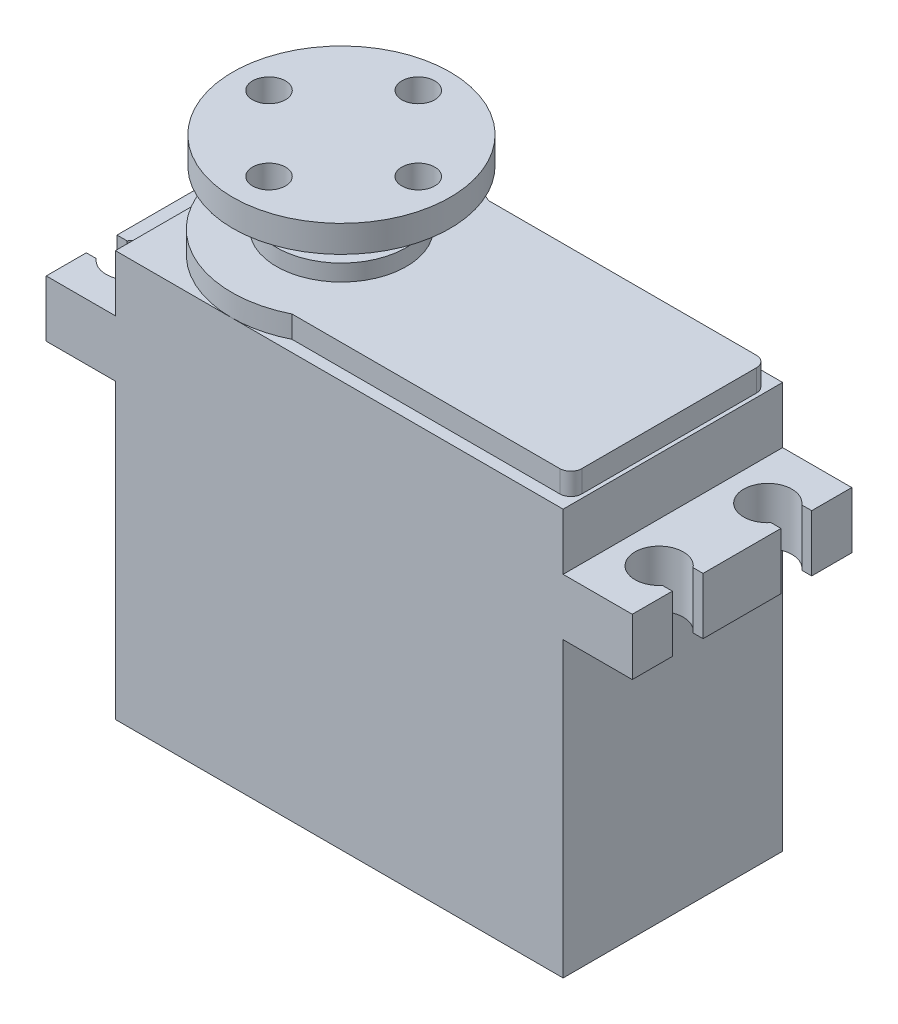
from build123d import *

# Parameters (mm, degrees)
SKETCH9_W                         = 53.4
SKETCH9_H                         = 37
BOSS_EXTRUDE3_DEPTH               = 20
BOSS_EXTRUDE4_DEPTH               = 2
SKETCH15_W                        = 6.3
SKETCH15_H                        = 26.7
CUT_EXTRUDE1_DEPTH                = 52.321438016
SKETCH16_W                        = 6.3
SKETCH16_H                        = 5.145561791
CUT_EXTRUDE2_DEPTH                = 52.321438016
SKETCH17_W                        = 6.3
SKETCH17_H                        = 5.145561791
CUT_EXTRUDE3_DEPTH                = 52.321438016
CUT_EXTRUDE4_DEPTH                = 43.750382848
CUT_EXTRUDE5_DEPTH                = 43.750382848
SKETCH30_W                        = 6.3
SKETCH30_H                        = 26.7
CUT_EXTRUDE6_DEPTH                = 52.321438016
CUT_EXTRUDE7_DEPTH                = 43.750382848
CUT_EXTRUDE8_DEPTH                = 43.750382848
SKETCH40_W                        = 5.917139292
SKETCH40_H                        = 1.5
SKETCH47_W                        = 2.2
SKETCH47_H                        = 5.154438209
SKETCH55_W                        = 2.2
SKETCH55_H                        = 5.154438209
SKETCH64_W                        = 2.2
SKETCH64_H                        = 5.154438209
SKETCH72_W                        = 2.2
SKETCH72_H                        = 5.154438209
F_3_0_3_DIAMETER_HOLE2_D          = 3
F_3_0_3_DIAMETER_HOLE2_DEPTH      = 1.5
FILLET1_R                         = 1
SKETCH76_W                        = 9.9
SKETCH76_H                        = 2.45
SKETCH85_R                        = 4.5
BOSS_EXTRUDE5_DEPTH               = 2.25
BOSS_EXTRUDE6_START               = 1.25
SKETCH86_R                        = 1.5
BOSS_EXTRUDE6_DEPTH               = 1.25
SKETCH87_W                        = 1.5
SKETCH87_H                        = 46.45
F_3_0_3_DIAMETER_HOLE3_AT_2_COUNT = 2
F_3_0_3_DIAMETER_HOLE3_AT_2_PITCH = 9.617734802
F_3_0_3_DIAMETER_HOLE3_AT_3_COUNT = 2
F_3_0_3_DIAMETER_HOLE3_AT_3_PITCH = 13.601530997
F_3_0_3_DIAMETER_HOLE3_AT_4_COUNT = 2
F_3_0_3_DIAMETER_HOLE3_AT_4_PITCH = 9.617734802
SKETCH89_W                        = 40.8
SKETCH89_H                        = 20
BOSS_EXTRUDE7_DEPTH               = 10
BOSS_EXTRUDE8_DEPTH               = 10
SKETCH91_R                        = 5.917139292
BOSS_EXTRUDE9_DEPTH               = 10


with BuildPart() as part:
    # Sketch9 → Boss-Extrude3 (new body)
    with BuildSketch(Plane(origin=(0, 0, -10), x_dir=(-1, 0, 0), z_dir=(0, 0, -1))):
        with Locations((0, 18.5)):
            Rectangle(SKETCH9_W, SKETCH9_H)
    extrude(amount=-BOSS_EXTRUDE3_DEPTH)

    # Sketch10 → Boss-Extrude4 (add)
    with BuildSketch(Plane(origin=(0, 37, 0), x_dir=(-1, 0, 0), z_dir=(0, 1, 0))):
        with BuildLine():
            Line((-20.05, -8.952596504), (-20.05, 8.952596504))
            Line((-20.05, 8.952596504), (5.344552118, 8.952596504))
            ThreePointArc((5.344552118, 8.952596504), (19.8, 0), (5.344552118, -8.952596504))
            Line((5.344552118, -8.952596504), (-20.05, -8.952596504))
        make_face()
    extrude(amount=BOSS_EXTRUDE4_DEPTH)

    # Sketch15 → Cut-Extrude1 (cut, through all)
    with BuildSketch(Plane.XY.offset(10)):
        with Locations((-23.55, 13.35)):
            Rectangle(SKETCH15_W, SKETCH15_H)
    extrude(amount=-CUT_EXTRUDE1_DEPTH, mode=Mode.SUBTRACT)

    # Sketch16 → Cut-Extrude2 (cut, through all)
    with BuildSketch(Plane.XY.offset(10)):
        with Locations((-23.55, 34.427219104)):
            Rectangle(SKETCH16_W, SKETCH16_H)
    extrude(amount=-CUT_EXTRUDE2_DEPTH, mode=Mode.SUBTRACT)

    # Sketch17 → Cut-Extrude3 (cut, through all)
    with BuildSketch(Plane.XY.offset(10)):
        with Locations((23.55, 34.427219104)):
            Rectangle(SKETCH17_W, SKETCH17_H)
    extrude(amount=-CUT_EXTRUDE3_DEPTH, mode=Mode.SUBTRACT)

    # Sketch23 → Cut-Extrude4 (cut, through all)
    with BuildSketch(Plane(origin=(0, 31.854438209, 0), x_dir=(1, 0, 0), z_dir=(0, 1, 0))):
        with BuildLine():
            Line((-26.7, -3.55), (-26.7, -6.35))
            Line((-26.7, -6.35), (-25.797056275, -6.35))
            ThreePointArc((-25.797056275, -6.35), (-26.3, -4.95), (-25.797056275, -3.55))
            Line((-25.797056275, -3.55), (-26.7, -3.55))
        make_face()
    extrude(amount=-CUT_EXTRUDE4_DEPTH, mode=Mode.SUBTRACT)

    # Sketch24 → Cut-Extrude5 (cut, through all)
    with BuildSketch(Plane(origin=(0, 31.854438209, 0), x_dir=(-1, 0, 0), z_dir=(0, 1, 0))):
        with BuildLine():
            Line((26.7, -3.55), (25.797056275, -3.55))
            ThreePointArc((25.797056275, -3.55), (26.3, -4.95), (25.797056275, -6.35))
            Line((25.797056275, -6.35), (26.7, -6.35))
            Line((26.7, -6.35), (26.7, -3.55))
        make_face()
    extrude(amount=-CUT_EXTRUDE5_DEPTH, mode=Mode.SUBTRACT)

    # Sketch30 → Cut-Extrude6 (cut, through all)
    with BuildSketch(Plane.XY.offset(10)):
        with Locations((23.55, 13.35)):
            Rectangle(SKETCH30_W, SKETCH30_H)
    extrude(amount=-CUT_EXTRUDE6_DEPTH, mode=Mode.SUBTRACT)

    # Sketch37 → Cut-Extrude7 (cut, through all)
    with BuildSketch(Plane(origin=(0, 31.854438209, 0), x_dir=(1, 0, 0), z_dir=(0, 1, 0))):
        with BuildLine():
            Line((26.7, 3.55), (26.7, 6.35))
            Line((26.7, 6.35), (25.797056275, 6.35))
            ThreePointArc((25.797056275, 6.35), (26.3, 4.95), (25.797056275, 3.55))
            Line((25.797056275, 3.55), (26.7, 3.55))
        make_face()
    extrude(amount=-CUT_EXTRUDE7_DEPTH, mode=Mode.SUBTRACT)

    # Sketch38 → Cut-Extrude8 (cut, through all)
    with BuildSketch(Plane(origin=(0, 31.854438209, 0), x_dir=(-1, 0, 0), z_dir=(0, 1, 0))):
        with BuildLine():
            Line((-26.7, 3.55), (-25.797056275, 3.55))
            ThreePointArc((-25.797056275, 3.55), (-26.3, 4.95), (-25.797056275, 6.35))
            Line((-25.797056275, 6.35), (-26.7, 6.35))
            Line((-26.7, 6.35), (-26.7, 3.55))
        make_face()
    extrude(amount=-CUT_EXTRUDE8_DEPTH, mode=Mode.SUBTRACT)

    # Sketch40 → Revolve2 (revolve)
    with BuildSketch(Plane.XY, mode=Mode.PRIVATE) as revolve2_sk:
        with Locations((-6.841430354, 39.75)):
            Rectangle(SKETCH40_W, SKETCH40_H)
    revolve(revolve2_sk.sketch.rotate(Axis((-9.8, 40.5, 0), (0, -1, 0)), 270), axis=Axis((-9.8, 40.5, 0), (0, -1, 0)))

    # Sketch47 → Cut-Revolve1 (revolve, cut)
    with BuildSketch(Plane(origin=(0, 0, -4.95), x_dir=(-1, 0, 0), z_dir=(0, 0, -1))):
        with Locations((23, 29.277219105)):
            Rectangle(SKETCH47_W, SKETCH47_H)
    revolve(axis=Axis((-24.1, 26.7, -4.95), (0, 1, 0)), mode=Mode.SUBTRACT)

    # Sketch55 → Cut-Revolve2 (revolve, cut)
    with BuildSketch(Plane(origin=(0, 0, 4.95), x_dir=(-1, 0, 0), z_dir=(0, 0, -1))):
        with Locations((-25.2, 29.277219105)):
            Rectangle(SKETCH55_W, SKETCH55_H)
    revolve(axis=Axis((24.1, 26.7, 4.95), (0, 1, 0)), mode=Mode.SUBTRACT)

    # Sketch64 → Cut-Revolve3 (revolve, cut)
    with BuildSketch(Plane(origin=(0, 0, 4.95), x_dir=(-1, 0, 0), z_dir=(0, 0, -1))):
        with Locations((23, 29.277219105)):
            Rectangle(SKETCH64_W, SKETCH64_H)
    revolve(axis=Axis((-24.1, 26.7, 4.95), (0, 1, 0)), mode=Mode.SUBTRACT)

    # Sketch72 → Cut-Revolve4 (revolve, cut)
    with BuildSketch(Plane(origin=(0, 0, -4.95), x_dir=(-1, 0, 0), z_dir=(0, 0, -1))):
        with Locations((-25.2, 29.277219105)):
            Rectangle(SKETCH72_W, SKETCH72_H)
    revolve(axis=Axis((24.1, 26.7, -4.95), (0, 1, 0)), mode=Mode.SUBTRACT)

    # Ø3.0 (3) Diameter Hole2
    with Locations(Plane(origin=(0, 40.5, 0), x_dir=(1, 0, 0), z_dir=(0, 1, 0))):
        with Locations((-9.8, 0)):
            Hole(F_3_0_3_DIAMETER_HOLE2_D / 2, depth=F_3_0_3_DIAMETER_HOLE2_DEPTH)

    # Fillet1
    fillet1_edges = [part.edges().sort_by_distance(p)[0] for p in [
        (20.05, 38, 8.952596504),
        (20.05, 38, -8.952596504),
    ]]
    fillet(fillet1_edges, radius=FILLET1_R)


with BuildPart() as body_2:
    # Sketch76 → Revolve3 (revolve)
    with BuildSketch(Plane.XY, mode=Mode.PRIVATE) as revolve3_sk:
        with Locations((-4.85, 45.225)):
            Rectangle(SKETCH76_W, SKETCH76_H)
    revolve(revolve3_sk.sketch.rotate(Axis((-9.8, 46.45, 0), (0, -1, 0)), 270), axis=Axis((-9.8, 46.45, 0), (0, -1, 0)))

    # Sketch85 → Boss-Extrude5 (add)
    with BuildSketch(Plane(origin=(0, 44, 0), x_dir=(-1, 0, 0), z_dir=(0, -1, 0))):
        with Locations(Location((9.8, 0, 0), (0, 0, 90))):
            Circle(SKETCH85_R)
    extrude(amount=BOSS_EXTRUDE5_DEPTH)

    # Sketch86 → Boss-Extrude6 (add)
    with BuildSketch(Plane.XZ.offset(-41.75).offset(BOSS_EXTRUDE6_START)):
        with Locations(Location((-9.8, 0, 0), (0, 0, 270))):
            Circle(SKETCH86_R)
    extrude(amount=-BOSS_EXTRUDE6_DEPTH)


with BuildPart() as f_3_0_3_diameter_hole3_tool:
    # Sketch87 → Ø3.0 (3) Diameter Hole3 (revolve)
    with BuildSketch(Plane(origin=(-2.999234502, 46.45, -0.199234502), x_dir=(0, 0, 1), z_dir=(1, 0, 0))):
        with Locations((0.75, 23.225)):
            Rectangle(SKETCH87_W, SKETCH87_H)
    f_3_0_3_diameter_hole3 = revolve(axis=Axis((-2.999234502, 52.8, -0.199234502), (0, -1, 0)))


with BuildPart() as part_1:
    add(part.part)

    # Ø3.0 (3) Diameter Hole3: cut by f_3_0_3_diameter_hole3_tool
    add(f_3_0_3_diameter_hole3_tool.part, mode=Mode.SUBTRACT)


with BuildPart() as body_2_1:
    add(body_2.part)

    # Ø3.0 (3) Diameter Hole3: cut by f_3_0_3_diameter_hole3_tool
    add(f_3_0_3_diameter_hole3_tool.part, mode=Mode.SUBTRACT)


with BuildPart() as f_3_0_3_diameter_hole3_at_2_tool:
    # Ø3.0 (3) Diameter Hole3 at 2: Ø3.0 (3) Diameter Hole3 ×2
    with Locations(*[Vector(-0.7071067811865412, 0, 0.7071067811865539) * (i * F_3_0_3_DIAMETER_HOLE3_AT_2_PITCH) for i in range(1, F_3_0_3_DIAMETER_HOLE3_AT_2_COUNT)]):
        add(f_3_0_3_diameter_hole3)


with BuildPart() as part_2:
    add(part_1.part)

    # Ø3.0 (3) Diameter Hole3 at 2: cut by f_3_0_3_diameter_hole3_at_2_tool
    add(f_3_0_3_diameter_hole3_at_2_tool.part, mode=Mode.SUBTRACT)


with BuildPart() as body_2_2:
    add(body_2_1.part)

    # Ø3.0 (3) Diameter Hole3 at 2: cut by f_3_0_3_diameter_hole3_at_2_tool
    add(f_3_0_3_diameter_hole3_at_2_tool.part, mode=Mode.SUBTRACT)


with BuildPart() as f_3_0_3_diameter_hole3_at_3_tool:
    # Ø3.0 (3) Diameter Hole3 at 3: Ø3.0 (3) Diameter Hole3 ×2
    with Locations(*[(-i * F_3_0_3_DIAMETER_HOLE3_AT_3_PITCH, 0, 0) for i in range(1, F_3_0_3_DIAMETER_HOLE3_AT_3_COUNT)]):
        add(f_3_0_3_diameter_hole3)


with BuildPart() as part_3:
    add(part_2.part)

    # Ø3.0 (3) Diameter Hole3 at 3: cut by f_3_0_3_diameter_hole3_at_3_tool
    add(f_3_0_3_diameter_hole3_at_3_tool.part, mode=Mode.SUBTRACT)


with BuildPart() as body_2_3:
    add(body_2_2.part)

    # Ø3.0 (3) Diameter Hole3 at 3: cut by f_3_0_3_diameter_hole3_at_3_tool
    add(f_3_0_3_diameter_hole3_at_3_tool.part, mode=Mode.SUBTRACT)


with BuildPart() as f_3_0_3_diameter_hole3_at_4_tool:
    # Ø3.0 (3) Diameter Hole3 at 4: Ø3.0 (3) Diameter Hole3 ×2
    with Locations(*[Vector(-0.707106781186556, 0, -0.7071067811865391) * (i * F_3_0_3_DIAMETER_HOLE3_AT_4_PITCH) for i in range(1, F_3_0_3_DIAMETER_HOLE3_AT_4_COUNT)]):
        add(f_3_0_3_diameter_hole3)


with BuildPart() as part_4:
    add(part_3.part)

    # Ø3.0 (3) Diameter Hole3 at 4: cut by f_3_0_3_diameter_hole3_at_4_tool
    add(f_3_0_3_diameter_hole3_at_4_tool.part, mode=Mode.SUBTRACT)

    # Sketch89 → Boss-Extrude7 (add)
    with BuildSketch(Plane.XZ):
        Rectangle(SKETCH89_W, SKETCH89_H)
    extrude(amount=-BOSS_EXTRUDE7_DEPTH)

    # Sketch90 → Boss-Extrude8 (add)
    with BuildSketch(Plane(origin=(0, 39, 0), x_dir=(1, 0, 0), z_dir=(0, 1, 0))):
        with BuildLine():
            Line((20.05, -7.952596504), (20.05, 7.952596504))
            ThreePointArc((20.05, 7.952596504), (19.757106781, 8.659703286), (19.05, 8.952596504))
            Line((19.05, 8.952596504), (-5.344552118, 8.952596504))
            ThreePointArc((-5.344552118, 8.952596504), (-19.8, 0), (-5.344552118, -8.952596504))
            Line((-5.344552118, -8.952596504), (19.05, -8.952596504))
            ThreePointArc((19.05, -8.952596504), (19.757106781, -8.659703286), (20.05, -7.952596504))
        make_face()
    extrude(amount=-BOSS_EXTRUDE8_DEPTH)

    # Sketch91 → Boss-Extrude9 (add)
    with BuildSketch(Plane(origin=(0, 40.5, 0), x_dir=(1, 0, 0), z_dir=(0, 1, 0))):
        with Locations(Location((-9.8, 0, 0), (0, 0, 90))):
            Circle(SKETCH91_R)
    extrude(amount=-BOSS_EXTRUDE9_DEPTH)


with BuildPart() as body_2_4:
    add(body_2_3.part)

    # Ø3.0 (3) Diameter Hole3 at 4: cut by f_3_0_3_diameter_hole3_at_4_tool
    add(f_3_0_3_diameter_hole3_at_4_tool.part, mode=Mode.SUBTRACT)


solid = Compound([part_4.part, body_2_4.part])
